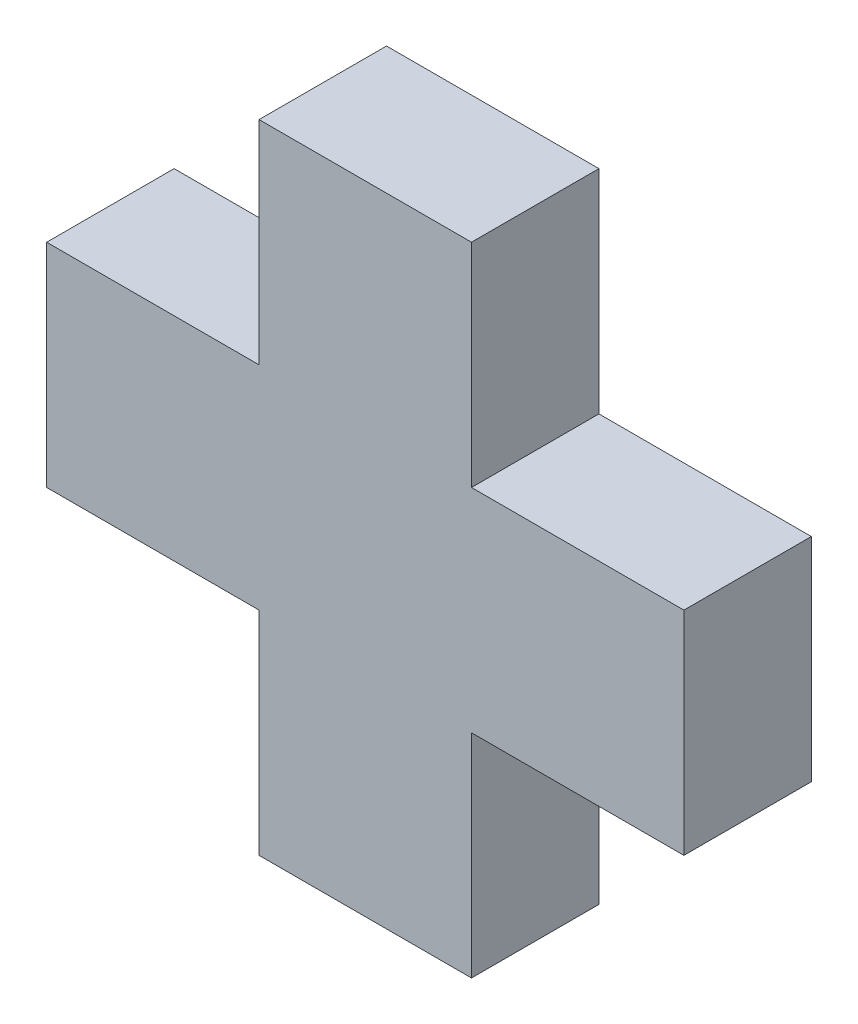
from build123d import *

# Parameters (mm, degrees)
BOSS_EXTRUDE1_DEPTH = 2


with BuildPart() as part:
    # Sketch1 → Boss-Extrude1 (new body)
    with BuildSketch(Plane.XY):
        Polygon((-2.75462963, 3.865740741), (-2.75462963, 0.532407407), (-6.087962963, 0.532407407), (-6.087962963, -2.800925926), (-2.75462963, -2.800925926), (-2.75462963, -6.134259259), (0.578703704, -6.134259259), (0.578703704, -2.800925926), (3.912037037, -2.800925926), (3.912037037, 0.532407407), (0.578703704, 0.532407407), (0.578703704, 3.865740741), align=None)
    extrude(amount=BOSS_EXTRUDE1_DEPTH)


solid = part.part
